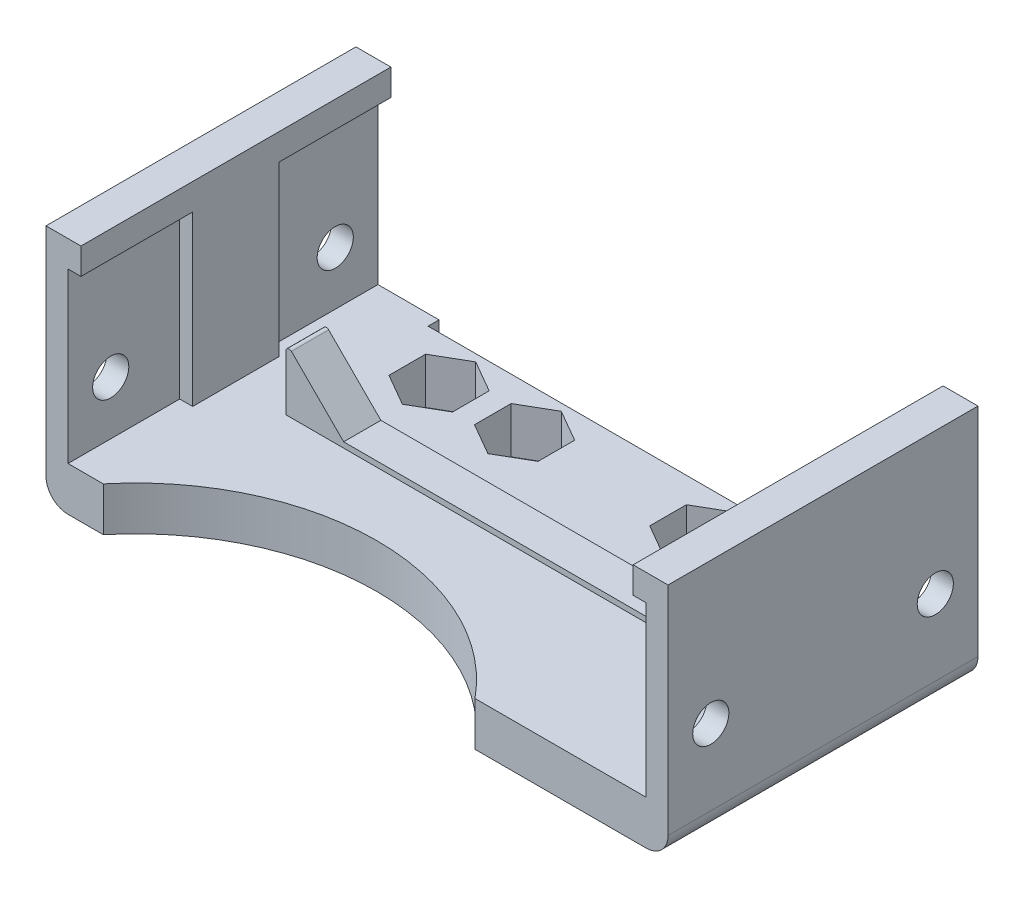
from build123d import *

# Parameters (mm, degrees)
BOSS_EXTRUDE1_DEPTH = 28.3
SKETCH2_W           = 52.78
SKETCH2_H           = 15.38
CUT_EXTRUDE1_DEPTH  = 10.2
CUT_EXTRUDE2_START  = 28.3
SKETCH2_2_W         = 52.78
SKETCH2_2_H         = 15.38
CUT_EXTRUDE2_DEPTH  = 10.2
CUT_EXTRUDE3_REACH  = 69.103
SKETCH3_R           = 1.65
BOSS_EXTRUDE2_START = 11.1
BOSS_EXTRUDE2_DEPTH = 3.4
CUT_EXTRUDE4_DEPTH  = 4.02
SKETCH6_R           = 1.65
BOSS_EXTRUDE3_DEPTH = 3.2
CUT_EXTRUDE5_DEPTH  = 4.22
SKETCH10_W          = 41.62
SKETCH10_H          = 8.42
CUT_EXTRUDE6_DEPTH  = 1


with BuildPart() as part:
    # Sketch1 → Boss-Extrude1 (new body)
    with BuildSketch(Plane.XY):
        with BuildLine():
            Line((0, 21.81), (3.19, 21.81))
            Line((3.19, 21.81), (3.19, 4.02))
            Line((3.19, 4.02), (53.61, 4.02))
            Line((53.61, 4.02), (53.61, 21.81))
            Line((53.61, 21.81), (56.8, 21.81))
            Line((56.8, 21.81), (56.8, 2))
            ThreePointArc((56.8, 2), (56.214213562, 0.585786438), (54.8, 0))
            Line((54.8, 0), (2, 0))
            ThreePointArc((2, 0), (0.585786438, 0.585786438), (0, 2))
            Line((0, 2), (0, 21.81))
        make_face()
    extrude(amount=BOSS_EXTRUDE1_DEPTH)

    # Sketch2 → Cut-Extrude1 (cut)
    with BuildSketch(Plane.XY):
        with Locations((28.4, 11.71)):
            Rectangle(SKETCH2_W, SKETCH2_H)
    extrude(amount=CUT_EXTRUDE1_DEPTH, mode=Mode.SUBTRACT)

    # Sketch2<2> → Cut-Extrude2 (cut)
    with BuildSketch(Plane.XY.offset(CUT_EXTRUDE2_START)):
        with Locations((28.4, 11.71)):
            Rectangle(SKETCH2_2_W, SKETCH2_2_H)
    extrude(amount=-CUT_EXTRUDE2_DEPTH, mode=Mode.SUBTRACT)

    # Cut-Extrude3: up to this face of the body (flat: up to its plane)
    cut_extrude3_end = Plane(part.part.faces().sort_by_distance((56.8, 11.905, 14.15))[0])
    # Sketch3 → Cut-Extrude3 (cut, up to the picked face)
    with BuildSketch(Plane.ZY, mode=Mode.PRIVATE) as cut_extrude3_sk1:
        with Locations((3.9, 8.91)):
            Circle(SKETCH3_R)
    cut_extrude3_tool1 = split(extrude(cut_extrude3_sk1.sketch, amount=-CUT_EXTRUDE3_REACH, mode=Mode.PRIVATE), bisect_by=cut_extrude3_end, keep=Keep.BOTH, mode=Mode.PRIVATE)
    # Sketch3 → Cut-Extrude3 (cut, up to the picked face)
    with BuildSketch(Plane.ZY, mode=Mode.PRIVATE) as cut_extrude3_sk2:
        with Locations((24.4, 8.91)):
            Circle(SKETCH3_R)
    cut_extrude3_tool2 = split(extrude(cut_extrude3_sk2.sketch, amount=-CUT_EXTRUDE3_REACH, mode=Mode.PRIVATE), bisect_by=cut_extrude3_end, keep=Keep.BOTH, mode=Mode.PRIVATE)
    add(cut_extrude3_tool1.solids().sort_by(Axis((0, 8.91, 3.9), (1, 0, 0)))[0], mode=Mode.SUBTRACT)
    add(cut_extrude3_tool2.solids().sort_by(Axis((0, 8.91, 24.4), (1, 0, 0)))[0], mode=Mode.SUBTRACT)

    # Sketch4 → Boss-Extrude2 (add)
    with BuildSketch(Plane.XY.offset(BOSS_EXTRUDE2_START)):
        with BuildLine():
            Line((8.612132034, 9.286042559), (13.378174593, 4.52))
            Line((13.378174593, 4.52), (43.421825407, 4.52))
            Line((43.421825407, 4.52), (48.187867966, 9.286042559))
            ThreePointArc((48.187867966, 9.286042559), (48.51480503, 9.351074384), (48.7, 9.073910524))
            Line((48.7, 9.073910524), (48.7, 4.02))
            Line((48.7, 4.02), (8.1, 4.02))
            Line((8.1, 4.02), (8.1, 9.073910524))
            ThreePointArc((8.1, 9.073910524), (8.28519497, 9.351074384), (8.612132034, 9.286042559))
        make_face()
    extrude(amount=BOSS_EXTRUDE2_DEPTH)

    # Sketch5 → Cut-Extrude4 (cut)
    with BuildSketch(Plane.XZ):
        with BuildLine():
            Line((5.229437252, 28.3), (39.170562748, 28.3))
            ThreePointArc((39.170562748, 28.3), (22.2, 20.3), (5.229437252, 28.3))
        make_face()
    extrude(amount=-CUT_EXTRUDE4_DEPTH, mode=Mode.SUBTRACT)

    # Sketch6 → Boss-Extrude3 (add)
    # profile 1 of 2: a face of its own
    with BuildSketch(Plane.XZ):
        with BuildLine():
            Line((9.09, 1), (23.9, 1))
            ThreePointArc((23.9, 1), (24.960660172, 1.439339828), (25.4, 2.5))
            Line((25.4, 2.5), (25.4, 7.5))
            ThreePointArc((25.4, 7.5), (24.960660172, 8.560660172), (23.9, 9))
            Line((23.9, 9), (9.09, 9))
            ThreePointArc((9.09, 9), (8.029339828, 8.560660172), (7.59, 7.5))
            Line((7.59, 7.5), (7.59, 2.5))
            ThreePointArc((7.59, 2.5), (8.029339828, 1.439339828), (9.09, 1))
        make_face()
        with Locations(Location((20.4, 5, 0), (0, 0, 270))):
            Circle(SKETCH6_R, mode=Mode.SUBTRACT)
        with Locations(Location((12.59, 5, 0), (0, 0, 270))):
            Circle(SKETCH6_R, mode=Mode.SUBTRACT)
    # profile 2 of 2: a face of its own
    with BuildSketch(Plane.XZ):
        with BuildLine():
            Line((32.9, 9), (47.71, 9))
            ThreePointArc((47.71, 9), (48.770660172, 8.560660172), (49.21, 7.5))
            Line((49.21, 7.5), (49.21, 2.5))
            ThreePointArc((49.21, 2.5), (48.770660172, 1.439339828), (47.71, 1))
            Line((47.71, 1), (32.9, 1))
            ThreePointArc((32.9, 1), (31.839339828, 1.439339828), (31.4, 2.5))
            Line((31.4, 2.5), (31.4, 7.5))
            ThreePointArc((31.4, 7.5), (31.839339828, 8.560660172), (32.9, 9))
        make_face()
        with Locations(Location((36.4, 5, 0), (0, 0, 270))):
            Circle(SKETCH6_R, mode=Mode.SUBTRACT)
        with Locations(Location((44.21, 5, 0), (0, 0, 270))):
            Circle(SKETCH6_R, mode=Mode.SUBTRACT)
    extrude(amount=BOSS_EXTRUDE3_DEPTH)

    # Sketch8 → Cut-Extrude5 (cut)
    with BuildSketch(Plane.XZ.offset(-4.02)):
        Polygon((23.3, 6.674315781), (20.4, 8.348631561), (17.5, 6.674315781), (17.5, 3.325684219), (20.4, 1.651368439), (23.3, 3.325684219), align=None)
        Polygon((39.3, 6.674315781), (36.4, 8.348631561), (33.5, 6.674315781), (33.5, 3.325684219), (36.4, 1.651368439), (39.3, 3.325684219), align=None)
        Polygon((47.11, 6.674315781), (44.21, 8.348631561), (41.31, 6.674315781), (41.31, 3.325684219), (44.21, 1.651368439), (47.11, 3.325684219), align=None)
        Polygon((15.49, 6.674315781), (12.59, 8.348631561), (9.69, 6.674315781), (9.69, 3.325684219), (12.59, 1.651368439), (15.49, 3.325684219), align=None)
    extrude(amount=CUT_EXTRUDE5_DEPTH, mode=Mode.SUBTRACT)

    # Sketch10 → Cut-Extrude6 (cut)
    with BuildSketch(Plane(origin=(0, 0, 0), x_dir=(-1, 0, 0), z_dir=(0, 0, -1))):
        with Locations((-28.4, -0.19)):
            Rectangle(SKETCH10_W, SKETCH10_H)
    extrude(amount=-CUT_EXTRUDE6_DEPTH, mode=Mode.SUBTRACT)


solid = part.part
